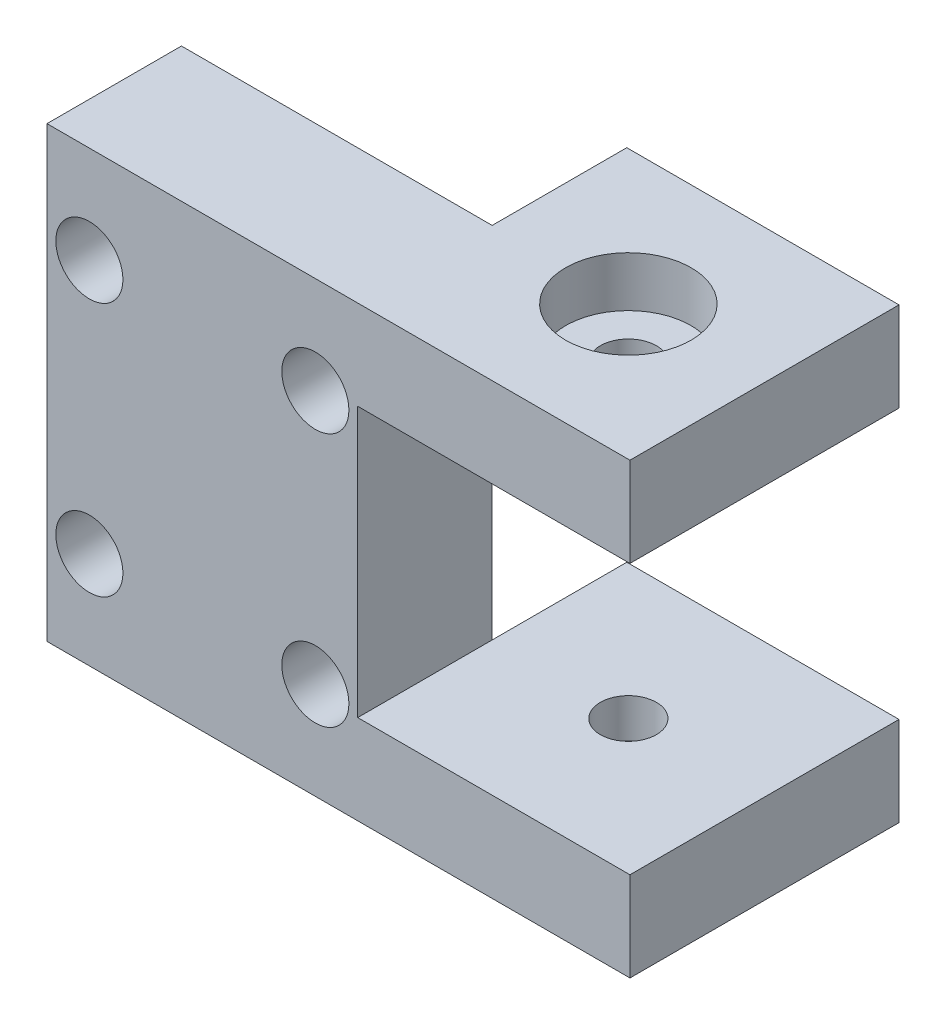
from build123d import *

# Parameters (mm, degrees)
SKETCH1_W               = 44
SKETCH1_H               = 63.5
SKETCH1_W_2             = 38.55
SKETCH1_H_2             = 12.661180653
BOSS_EXTRUDE1_DEPTH     = 19.038019
SKETCH1_3_W             = 38.55
SKETCH1_3_H             = 12.661180653
BOSS_EXTRUDE2_DEPTH     = 19.061980653
CUT_EXTRUDE1_DEPTH      = 197.962748017
CUT_EXTRUDE1_DEPTH_BACK = 197.962748017
SKETCH2_R               = 3.96875
CUT_EXTRUDE2_START      = -31.75
SKETCH2_3_R             = 8.89
SKETCH2_3_R_2           = 3.96875
CUT_EXTRUDE2_DEPTH      = 7.103661
CUT_EXTRUDE3_START      = 24.646339347
SKETCH2_4_R             = 8.89
SKETCH2_4_R_2           = 3.96875
CUT_EXTRUDE3_DEPTH      = 7.103660653
SKETCH3_R               = 2.65
CUT_EXTRUDE4_DEPTH      = 197.962748017
CUT_EXTRUDE5_START      = 6.349999653
SKETCH3_3_R             = 4.75
SKETCH3_3_R_2           = 2.65
SKETCH3_3_R_3           = 2.5
CUT_EXTRUDE5_DEPTH      = 12.688019347


with BuildPart() as part:
    # Sketch1 → Boss-Extrude1 (new body)
    with BuildSketch(Plane.XY):
        with Locations((-171.45, 0)):
            Rectangle(SKETCH1_W, SKETCH1_H)
        with Locations((-130.175, -25.419409674)):
            Rectangle(SKETCH1_W_2, SKETCH1_H_2)
        with Locations((-130.175, 25.419409674)):
            Rectangle(SKETCH1_W_2, SKETCH1_H_2)
    extrude(amount=BOSS_EXTRUDE1_DEPTH)

    # Sketch1<3> → Boss-Extrude2 (add)
    with BuildSketch(Plane.XY):
        with Locations((-130.175, 25.419409674)):
            Rectangle(SKETCH1_3_W, SKETCH1_3_H)
        with Locations((-130.175, -25.419409674)):
            Rectangle(SKETCH1_3_W, SKETCH1_3_H)
    extrude(amount=-BOSS_EXTRUDE2_DEPTH)

    # Sketch2 → Cut-Extrude1 (cut, two sides: drawn at the far end of the back side and taken through both)
    with BuildSketch(Plane(origin=(0, 0, 0), x_dir=(1, 0, 0), z_dir=(0, 1, 0)).offset(-CUT_EXTRUDE1_DEPTH_BACK)):
        with Locations(Location((-130.175, 0.011980653, 0), (0, 0, 270))):
            Circle(SKETCH2_R)
    extrude(amount=CUT_EXTRUDE1_DEPTH + CUT_EXTRUDE1_DEPTH_BACK, mode=Mode.SUBTRACT)

    # Sketch2<3> → Cut-Extrude2 (cut)
    with BuildSketch(Plane(origin=(0, 0, 0), x_dir=(1, 0, 0), z_dir=(0, 1, 0)).offset(CUT_EXTRUDE2_START)):
        with Locations(Location((-130.175, 0.011980653, 0), (0, 0, 270))):
            Circle(SKETCH2_3_R)
        with Locations(Location((-130.175, 0.011980653, 0), (0, 0, 270))):
            Circle(SKETCH2_3_R_2, mode=Mode.SUBTRACT)
    extrude(amount=CUT_EXTRUDE2_DEPTH, mode=Mode.SUBTRACT)

    # Sketch2<4> → Cut-Extrude3 (cut)
    with BuildSketch(Plane(origin=(0, 0, 0), x_dir=(1, 0, 0), z_dir=(0, 1, 0)).offset(CUT_EXTRUDE3_START)):
        with Locations(Location((-130.175, 0.011980653, 0), (0, 0, 270))):
            Circle(SKETCH2_4_R)
        with Locations(Location((-130.175, 0.011980653, 0), (0, 0, 270))):
            Circle(SKETCH2_4_R_2, mode=Mode.SUBTRACT)
    extrude(amount=CUT_EXTRUDE3_DEPTH, mode=Mode.SUBTRACT)

    # Sketch3 → Cut-Extrude4 (cut, through all)
    with BuildSketch(Plane.XY):
        with Locations((-187.45, 18)):
            Circle(SKETCH3_R)
        with Locations((-155.45, 18)):
            Circle(SKETCH3_R)
        with Locations((-155.45, -18)):
            Circle(SKETCH3_R)
        with Locations((-187.45, -18)):
            Circle(SKETCH3_R)
    extrude(amount=CUT_EXTRUDE4_DEPTH, mode=Mode.SUBTRACT)

    # Sketch3<3> → Cut-Extrude5 (cut)
    # profile 1 of 8: a face of its own
    with BuildSketch(Plane.XY.offset(CUT_EXTRUDE5_START)):
        with Locations((-187.45, 18)):
            Circle(SKETCH3_3_R)
        with Locations((-187.45, 18)):
            Circle(SKETCH3_3_R_2, mode=Mode.SUBTRACT)
    # profile 2 of 8: a face of its own
    with BuildSketch(Plane.XY.offset(CUT_EXTRUDE5_START)):
        with Locations((-187.45, 18)):
            Circle(SKETCH3_3_R_3)
    # profile 3 of 8: a face of its own
    with BuildSketch(Plane.XY.offset(CUT_EXTRUDE5_START)):
        with Locations((-155.45, 18)):
            Circle(SKETCH3_3_R)
        with Locations((-155.45, 18)):
            Circle(SKETCH3_3_R_2, mode=Mode.SUBTRACT)
    # profile 4 of 8: a face of its own
    with BuildSketch(Plane.XY.offset(CUT_EXTRUDE5_START)):
        with Locations((-155.45, 18)):
            Circle(SKETCH3_3_R_3)
    # profile 5 of 8: a face of its own
    with BuildSketch(Plane.XY.offset(CUT_EXTRUDE5_START)):
        with Locations((-155.45, -18)):
            Circle(SKETCH3_3_R)
        with Locations((-155.45, -18)):
            Circle(SKETCH3_3_R_2, mode=Mode.SUBTRACT)
    # profile 6 of 8: a face of its own
    with BuildSketch(Plane.XY.offset(CUT_EXTRUDE5_START)):
        with Locations((-155.45, -18)):
            Circle(SKETCH3_3_R_3)
    # profile 7 of 8: a face of its own
    with BuildSketch(Plane.XY.offset(CUT_EXTRUDE5_START)):
        with Locations((-187.45, -18)):
            Circle(SKETCH3_3_R)
        with Locations((-187.45, -18)):
            Circle(SKETCH3_3_R_2, mode=Mode.SUBTRACT)
    # profile 8 of 8: a face of its own
    with BuildSketch(Plane.XY.offset(CUT_EXTRUDE5_START)):
        with Locations((-187.45, -18)):
            Circle(SKETCH3_3_R_3)
    extrude(amount=CUT_EXTRUDE5_DEPTH, mode=Mode.SUBTRACT)


solid = part.part
